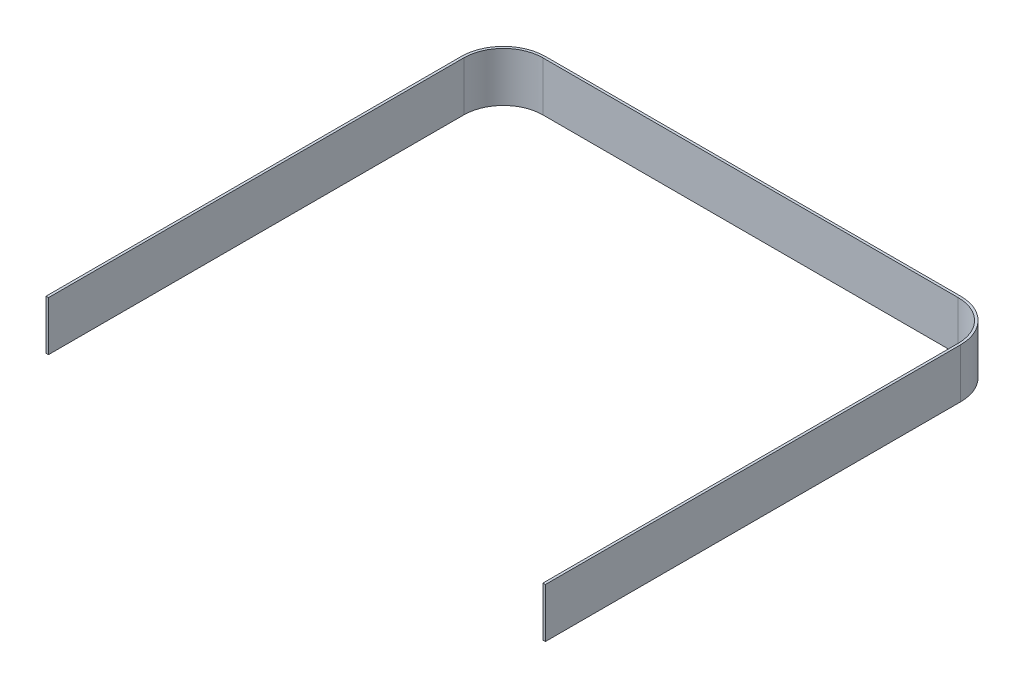
from build123d import *

# Parameters (mm, degrees)
EXTRUDE_THIN1_DEPTH = 63.5


with BuildPart() as part:
    # Sketch3 → Extrude-Thin1 (new body)
    with BuildSketch(Plane(origin=(0, 0, 0), x_dir=(1, 0, 0), z_dir=(0, 1, 0))):
        with BuildLine():
            Line((0, -584.2), (0, -50.8))
            ThreePointArc((0, -50.8), (14.878975516, -14.878975516), (50.8, 0))
            Line((50.8, 0), (584.2, 0))
            ThreePointArc((584.2, 0), (620.121024484, -14.878975516), (635, -50.8))
            Line((635, -50.8), (635, -584.2))
            Line((635, -584.2), (638.175, -584.2))
            Line((638.175, -584.2), (638.175, -50.8))
            ThreePointArc((638.175, -50.8), (622.366088515, -12.633911485), (584.2, 3.175))
            Line((584.2, 3.175), (50.8, 3.175))
            ThreePointArc((50.8, 3.175), (12.633911485, -12.633911485), (-3.175, -50.8))
            Line((-3.175, -50.8), (-3.175, -584.2))
            Line((-3.175, -584.2), (0, -584.2))
        make_face()
    extrude(amount=EXTRUDE_THIN1_DEPTH)


solid = part.part
